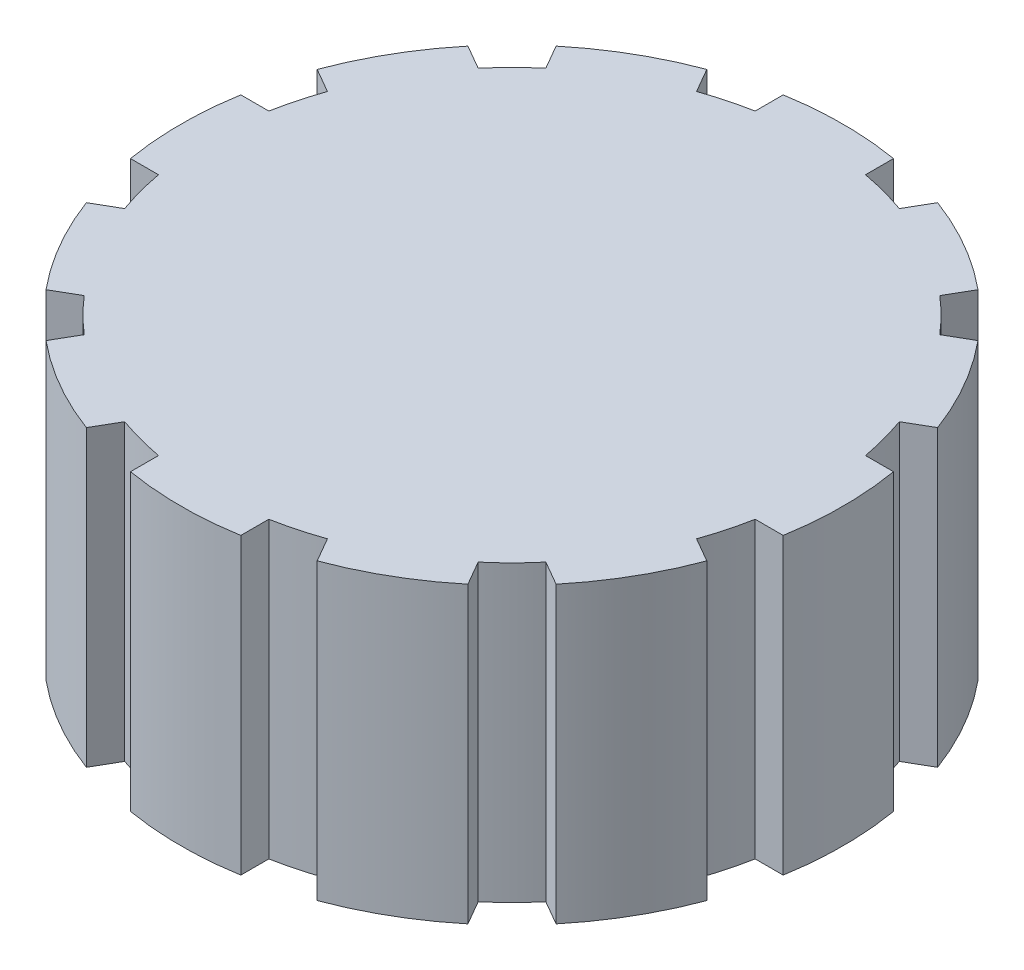
from build123d import *

# Parameters (mm, degrees)
EXTRUDE_1_DEPTH = 16


with BuildPart() as part:
    # 스케치1 → 보스-돌출1 (new body)
    with BuildSketch(Plane(origin=(0, 0, 0), x_dir=(1, 0, 0), z_dir=(0, 1, 0))):
        with BuildLine():
            ThreePointArc((3, 17.748239349), (0, 18), (-3, 17.748239349))
            Line((-3, 17.748239349), (-3, 16.22498074))
            ThreePointArc((-3, 16.22498074), (-4.270514244, 15.937776134), (-5.514414158, 15.551245496))
            Line((-5.514414158, 15.551245496), (-6.276043463, 16.870426149))
            ThreePointArc((-6.276043463, 16.870426149), (-9, 15.588457268), (-11.472195886, 13.870426149))
            Line((-11.472195886, 13.870426149), (-10.710566581, 12.551245496))
            ThreePointArc((-10.710566581, 12.551245496), (-11.66726189, 11.66726189), (-12.551245496, 10.710566581))
            Line((-12.551245496, 10.710566581), (-13.870426149, 11.472195886))
            ThreePointArc((-13.870426149, 11.472195886), (-15.588457268, 9), (-16.870426149, 6.276043463))
            Line((-16.870426149, 6.276043463), (-15.551245496, 5.514414158))
            ThreePointArc((-15.551245496, 5.514414158), (-15.937776134, 4.270514244), (-16.22498074, 3))
            Line((-16.22498074, 3), (-17.748239349, 3))
            ThreePointArc((-17.748239349, 3), (-18, 0), (-17.748239349, -3))
            Line((-17.748239349, -3), (-16.22498074, -3))
            ThreePointArc((-16.22498074, -3), (-15.937776134, -4.270514244), (-15.551245496, -5.514414158))
            Line((-15.551245496, -5.514414158), (-16.870426149, -6.276043463))
            ThreePointArc((-16.870426149, -6.276043463), (-15.588457268, -9), (-13.870426149, -11.472195886))
            Line((-13.870426149, -11.472195886), (-12.551245496, -10.710566581))
            ThreePointArc((-12.551245496, -10.710566581), (-11.66726189, -11.66726189), (-10.710566581, -12.551245496))
            Line((-10.710566581, -12.551245496), (-11.472195886, -13.870426149))
            ThreePointArc((-11.472195886, -13.870426149), (-9, -15.588457268), (-6.276043463, -16.870426149))
            Line((-6.276043463, -16.870426149), (-5.514414158, -15.551245496))
            ThreePointArc((-5.514414158, -15.551245496), (-4.270514244, -15.937776134), (-3, -16.22498074))
            Line((-3, -16.22498074), (-3, -17.748239349))
            ThreePointArc((-3, -17.748239349), (0, -18), (3, -17.748239349))
            Line((3, -17.748239349), (3, -16.22498074))
            ThreePointArc((3, -16.22498074), (4.270514244, -15.937776134), (5.514414158, -15.551245496))
            Line((5.514414158, -15.551245496), (6.276043463, -16.870426149))
            ThreePointArc((6.276043463, -16.870426149), (9, -15.588457268), (11.472195886, -13.870426149))
            Line((11.472195886, -13.870426149), (10.710566581, -12.551245496))
            ThreePointArc((10.710566581, -12.551245496), (11.66726189, -11.66726189), (12.551245496, -10.710566581))
            Line((12.551245496, -10.710566581), (13.870426149, -11.472195886))
            ThreePointArc((13.870426149, -11.472195886), (15.588457268, -9), (16.870426149, -6.276043463))
            Line((16.870426149, -6.276043463), (15.551245496, -5.514414158))
            ThreePointArc((15.551245496, -5.514414158), (15.937776134, -4.270514244), (16.22498074, -3))
            Line((16.22498074, -3), (17.748239349, -3))
            ThreePointArc((17.748239349, -3), (18, 0), (17.748239349, 3))
            Line((17.748239349, 3), (16.22498074, 3))
            ThreePointArc((16.22498074, 3), (15.937776134, 4.270514244), (15.551245496, 5.514414158))
            Line((15.551245496, 5.514414158), (16.870426149, 6.276043463))
            ThreePointArc((16.870426149, 6.276043463), (15.588457268, 9), (13.870426149, 11.472195886))
            Line((13.870426149, 11.472195886), (12.551245496, 10.710566581))
            ThreePointArc((12.551245496, 10.710566581), (11.66726189, 11.66726189), (10.710566581, 12.551245496))
            Line((10.710566581, 12.551245496), (11.472195886, 13.870426149))
            ThreePointArc((11.472195886, 13.870426149), (9, 15.588457268), (6.276043463, 16.870426149))
            Line((6.276043463, 16.870426149), (5.514414158, 15.551245496))
            ThreePointArc((5.514414158, 15.551245496), (4.270514244, 15.937776134), (3, 16.22498074))
            Line((3, 16.22498074), (3, 17.748239349))
        make_face()
    extrude(amount=EXTRUDE_1_DEPTH)


solid = part.part
